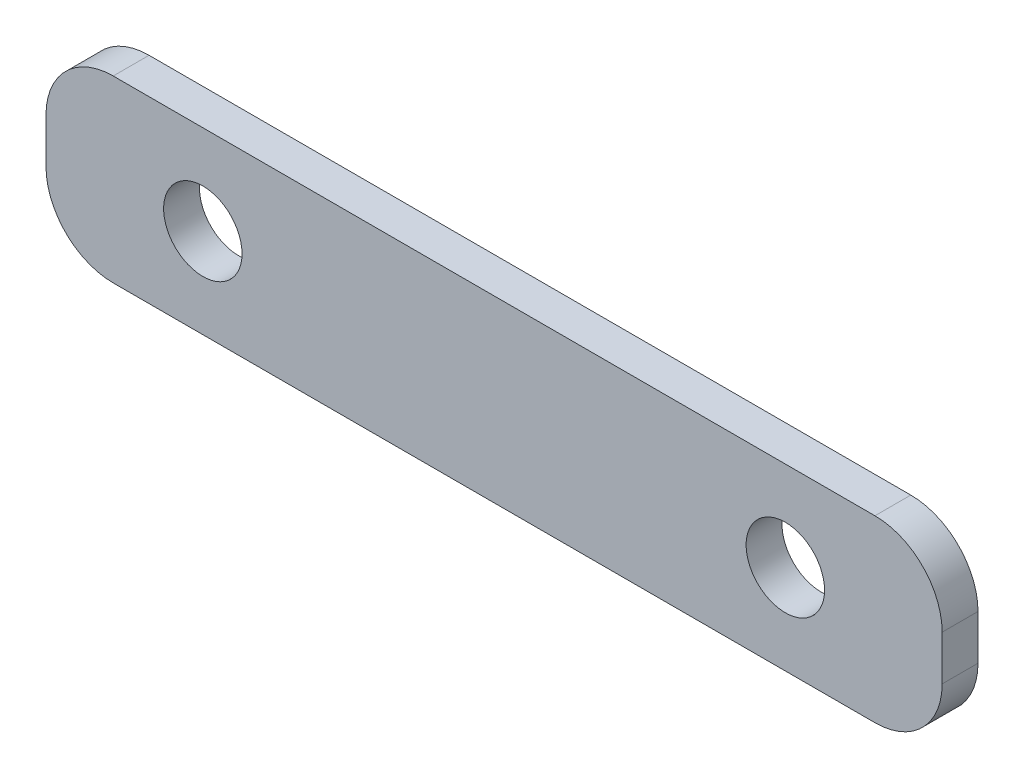
from build123d import *

# Parameters (mm, degrees)
ESBO_O1_W                                = 200
ESBO_O1_H                                = 40
RESSALTO_EXTRUS_O1_DEPTH                 = 4
FILETE2_R                                = 15
BROCA_DE_ROSQUEAR_PARA_TARRAXA_DE_M201_D = 17.5


with BuildPart() as part:
    # Esboço1 → Ressalto-extrusão1 (new, symmetric)
    with BuildSketch(Plane.XY):
        with Locations((100, 20)):
            Rectangle(ESBO_O1_W, ESBO_O1_H)
    extrude(amount=RESSALTO_EXTRUS_O1_DEPTH, both=True)

    # Filete2
    filete2_edges = [part.edges().sort_by_distance(p)[0] for p in [
        (0, 0, 0),
        (0, 40, 0),
        (200, 40, 0),
        (200, 0, 0),
    ]]
    fillet(filete2_edges, radius=FILETE2_R)

    # Broca de rosquear para tarraxa de M201 (through all)
    with Locations(Plane.XY.offset(4)):
        with Locations((35, 20), (165, 20)):
            Hole(BROCA_DE_ROSQUEAR_PARA_TARRAXA_DE_M201_D / 2)


solid = part.part
